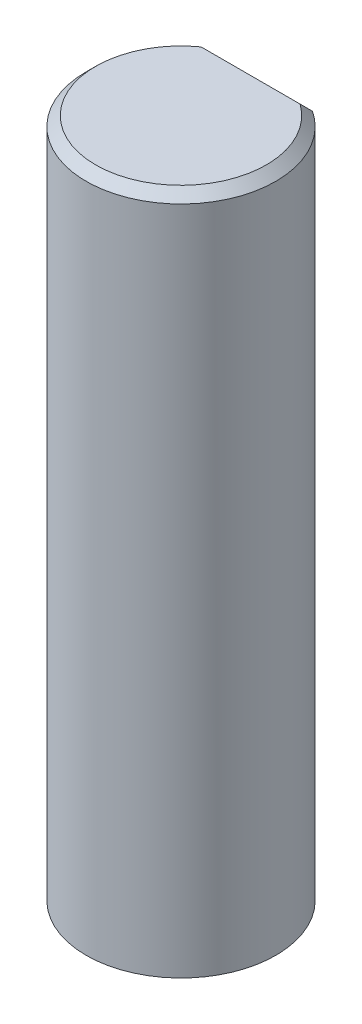
from build123d import *

# Parameters (mm, degrees)
CROQUIS1_R              = 3
SALIENTE_EXTRUIR1_DEPTH = 21.5
CORTAR_EXTRUIR1_START   = -12
CORTAR_EXTRUIR1_DEPTH   = 12
CHAFL_N1_SIZE           = 0.3


with BuildPart() as part:
    # Croquis1 → Saliente-Extruir1 (new body)
    with BuildSketch(Plane(origin=(0, 0, 0), x_dir=(1, 0, 0), z_dir=(0, 1, 0))):
        with Locations(Location((0, 0, 0), (0, 0, 270))):
            Circle(CROQUIS1_R)
    extrude(amount=SALIENTE_EXTRUIR1_DEPTH)

    # Croquis2 → Cortar-Extruir1 (cut)
    with BuildSketch(Plane(origin=(0, 21.5, 0), x_dir=(1, 0, 0), z_dir=(0, 1, 0)).offset(CORTAR_EXTRUIR1_START)):
        with BuildLine():
            Line((-1.658312395, 2.5), (1.658312395, 2.5))
            ThreePointArc((1.658312395, 2.5), (0, 3), (-1.658312395, 2.5))
        make_face()
    extrude(amount=CORTAR_EXTRUIR1_DEPTH, mode=Mode.SUBTRACT)

    # Chaflán1
    chafl_n1_edges = [part.edges().sort_by_distance(p)[0] for p in [
        (-2.872281323, 21.5, 0.866025404),
        (0, 21.5, -2.5),
    ]]
    chamfer(chafl_n1_edges, length=CHAFL_N1_SIZE)


solid = part.part
